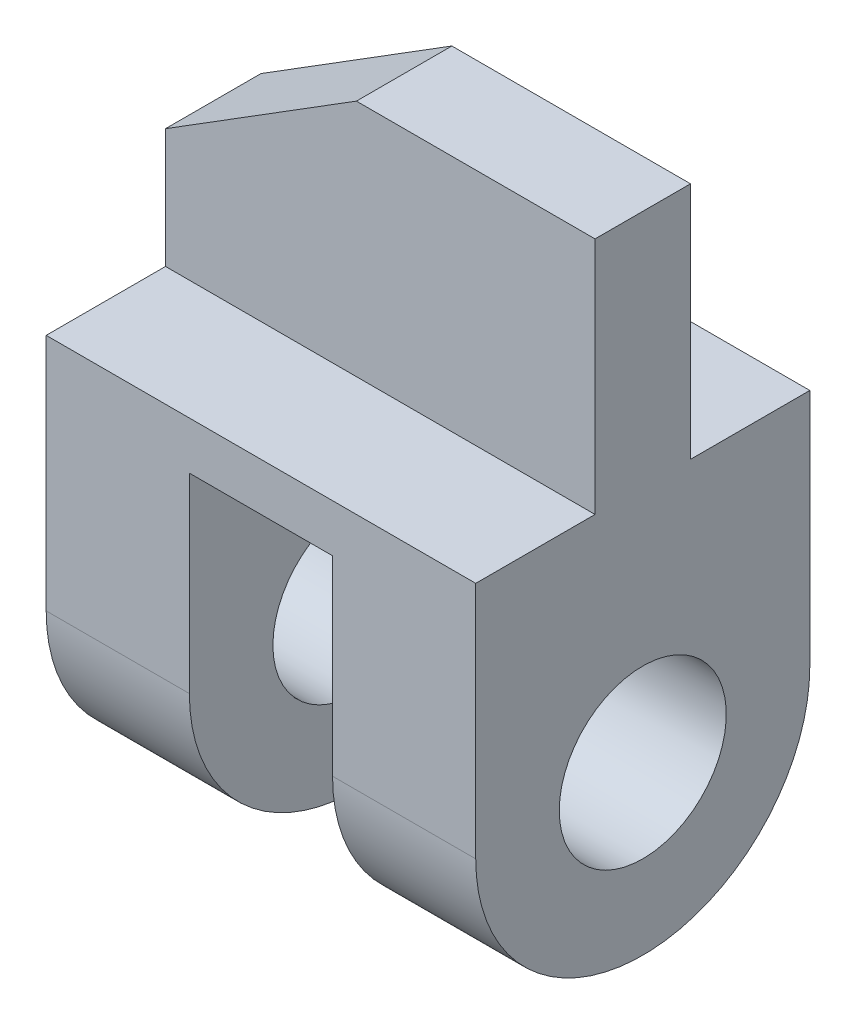
from build123d import *

# Parameters (mm, degrees)
BOSS_EXTRUDE1_DEPTH = 70
SKETCH4_R           = 17.5
CUT_EXTRUDE3_DEPTH  = 137
SKETCH6_W           = 25
SKETCH6_H           = 50
CUT_EXTRUDE4_DEPTH  = 137
SKETCH7_W           = 25
SKETCH7_H           = 50
CUT_EXTRUDE5_DEPTH  = 137
CUT_EXTRUDE6_DEPTH  = 137


with BuildPart() as part:
    # Sketch3 → Boss-Extrude1 (new body)
    with BuildSketch(Plane.XY):
        Polygon((24.962893573, 73.456383547), (24.962893573, -61.543616453), (-5.037106427, -61.543616453), (-5.037106427, 13.456383547), (-35.037106427, 13.456383547), (-35.037106427, -61.543616453), (-65.037106427, -61.543616453), (-65.037106427, 48.456383547), (-25.037106427, 73.456383547), align=None)
    extrude(amount=BOSS_EXTRUDE1_DEPTH)

    # Sketch4 → Cut-Extrude3 (cut)
    with BuildSketch(Plane.ZY.offset(65.037106427)):
        with Locations((35, -26.543616453)):
            Circle(SKETCH4_R)
    extrude(amount=-CUT_EXTRUDE3_DEPTH, mode=Mode.SUBTRACT)

    # Sketch6 → Cut-Extrude4 (cut)
    with BuildSketch(Plane(origin=(24.962893573, 0, 0), x_dir=(0, 0, -1), z_dir=(1, 0, 0))):
        with Locations((-57.5, 48.456383547)):
            Rectangle(SKETCH6_W, SKETCH6_H)
    extrude(amount=-CUT_EXTRUDE4_DEPTH, mode=Mode.SUBTRACT)

    # Sketch7 → Cut-Extrude5 (cut)
    with BuildSketch(Plane(origin=(24.962893573, 0, 0), x_dir=(0, 0, -1), z_dir=(1, 0, 0))):
        with Locations((-12.5, 48.456383547)):
            Rectangle(SKETCH7_W, SKETCH7_H)
    extrude(amount=-CUT_EXTRUDE5_DEPTH, mode=Mode.SUBTRACT)

    # Sketch8 → Cut-Extrude6 (cut)
    with BuildSketch(Plane.ZY.offset(65.037106427)):
        with BuildLine():
            ThreePointArc((35, -61.543616453), (10.251262658, -51.292353794), (0, -26.543616453))
            Line((0, -26.543616453), (0, -61.543616453))
            Line((0, -61.543616453), (35, -61.543616453))
        make_face()
        with BuildLine():
            Line((70, -61.543616453), (70, -26.543616453))
            ThreePointArc((70, -26.543616453), (59.748737342, -51.292353794), (35, -61.543616453))
            Line((35, -61.543616453), (70, -61.543616453))
        make_face()
    extrude(amount=-CUT_EXTRUDE6_DEPTH, mode=Mode.SUBTRACT)


solid = part.part
